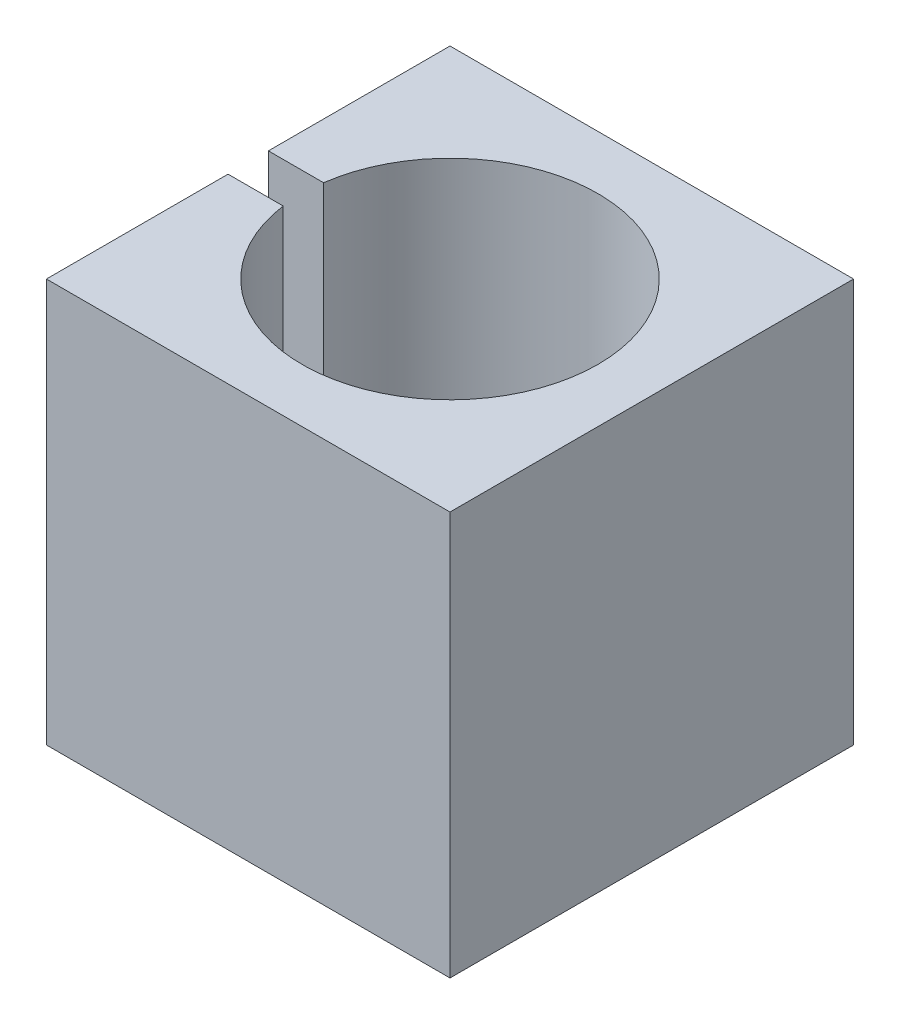
from build123d import *

# Parameters (mm, degrees)
SKETCH1_W           = 30
SKETCH1_H           = 30
SKETCH1_R           = 11
BOSS_EXTRUDE1_DEPTH = 30
SKETCH2_W           = 3
SKETCH2_H           = 30
CUT_EXTRUDE1_DEPTH  = 11
SKETCH4_W           = 30
SKETCH4_H           = 30
BOSS_EXTRUDE3_DEPTH = 5


with BuildPart() as part:
    # Sketch1 → Boss-Extrude1 (new body)
    with BuildSketch(Plane(origin=(0, 0, 0), x_dir=(1, 0, 0), z_dir=(0, 1, 0))):
        with Locations((0.359281437, -8.488023952)):
            Rectangle(SKETCH1_W, SKETCH1_H)
        with Locations((0.359281437, -8.488023952)):
            Circle(SKETCH1_R, mode=Mode.SUBTRACT)
    extrude(amount=BOSS_EXTRUDE1_DEPTH)

    # Sketch2 → Cut-Extrude1 (cut)
    with BuildSketch(Plane.ZY.offset(14.640718563)):
        with Locations((8.488023952, 15)):
            Rectangle(SKETCH2_W, SKETCH2_H)
    extrude(amount=-CUT_EXTRUDE1_DEPTH, mode=Mode.SUBTRACT)

    # Sketch4 → Boss-Extrude3 (add)
    with BuildSketch(Plane.XZ):
        with Locations((0.359281437, 8.488023952)):
            Rectangle(SKETCH4_W, SKETCH4_H)
    extrude(amount=-BOSS_EXTRUDE3_DEPTH)


solid = part.part
